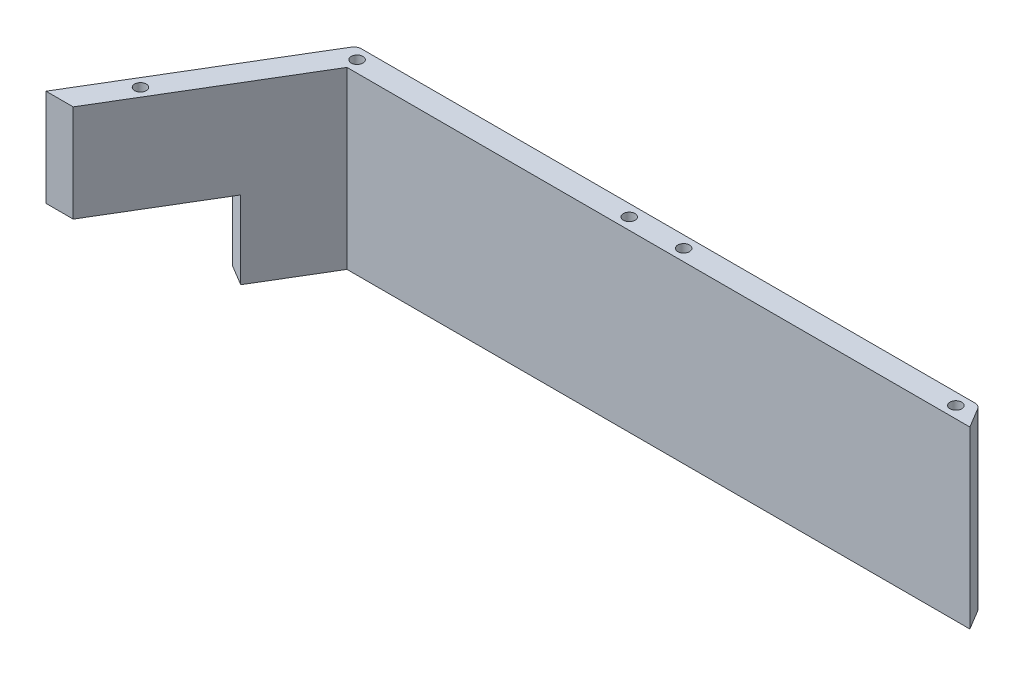
from build123d import *

# Parameters (mm, degrees)
BOSS_EXTRUDE1_DEPTH = 22.5
SKETCH2_R           = 1.5
CUT_EXTRUDE1_DEPTH  = 5
FILLET1_R           = 2
SKETCH3_W           = 35
SKETCH3_H           = 20
CUT_EXTRUDE2_DEPTH  = 10
SKETCH6_W           = 44
SKETCH6_H           = 45
CUT_EXTRUDE3_DEPTH  = 123.907485533


with BuildPart() as part:
    # Sketch1 → Boss-Extrude1 (new, symmetric)
    with BuildSketch(Plane(origin=(0, 0, 0), x_dir=(1, 0, 0), z_dir=(0, 1, 0))):
        Polygon((-110, 0), (-80, 50), (80, 50), (110, 0), (103, 0), (76.6, 44), (-76.6, 44), (-103, 0), align=None)
    extrude(amount=BOSS_EXTRUDE1_DEPTH, both=True)

    # Sketch2 → Cut-Extrude1 (cut)
    with BuildSketch(Plane(origin=(0, 22.5, 0), x_dir=(1, 0, 0), z_dir=(0, 1, 0))):
        with Locations(Location((-98.701428863, 13, 0), (0, 0, 270))):
            Circle(SKETCH2_R)
        with Locations(Location((-77, 47, 0), (0, 0, 270))):
            Circle(SKETCH2_R)
        with Locations(Location((-7, 47, 0), (0, 0, 270))):
            Circle(SKETCH2_R)
        with Locations(Location((7, 47, 0), (0, 0, 90))):
            Circle(SKETCH2_R)
        with Locations(Location((77, 47, 0), (0, 0, 90))):
            Circle(SKETCH2_R)
        with Locations(Location((98.701428863, 13, 0), (0, 0, 90))):
            Circle(SKETCH2_R)
    extrude(amount=-CUT_EXTRUDE1_DEPTH, mode=Mode.SUBTRACT)

    # Fillet1
    fillet1_edges = [part.edges().sort_by_distance(p)[0] for p in [
        (-80, 0, -50),
        (80, 0, -50),
    ]]
    fillet(fillet1_edges, radius=FILLET1_R)

    # Sketch3 → Cut-Extrude2 (cut)
    with BuildSketch(Plane(origin=(-80.882352941, 0, -48.529411765), x_dir=(-0.5144957554275265, 0, 0.8574929257125443), z_dir=(-0.8574929257125443, 0, -0.5144957554275265))):
        with Locations((39.094533097, -12.5)):
            Rectangle(SKETCH3_W, SKETCH3_H)
    extrude(amount=-CUT_EXTRUDE2_DEPTH, mode=Mode.SUBTRACT)

    # Sketch6 → Cut-Extrude3 (cut, through all)
    with BuildSketch(Plane(origin=(0, 0, 0), x_dir=(0, 0, -1), z_dir=(1, 0, 0))):
        with Locations((22, 0)):
            Rectangle(SKETCH6_W, SKETCH6_H)
    extrude(amount=CUT_EXTRUDE3_DEPTH, mode=Mode.SUBTRACT)


solid = part.part
